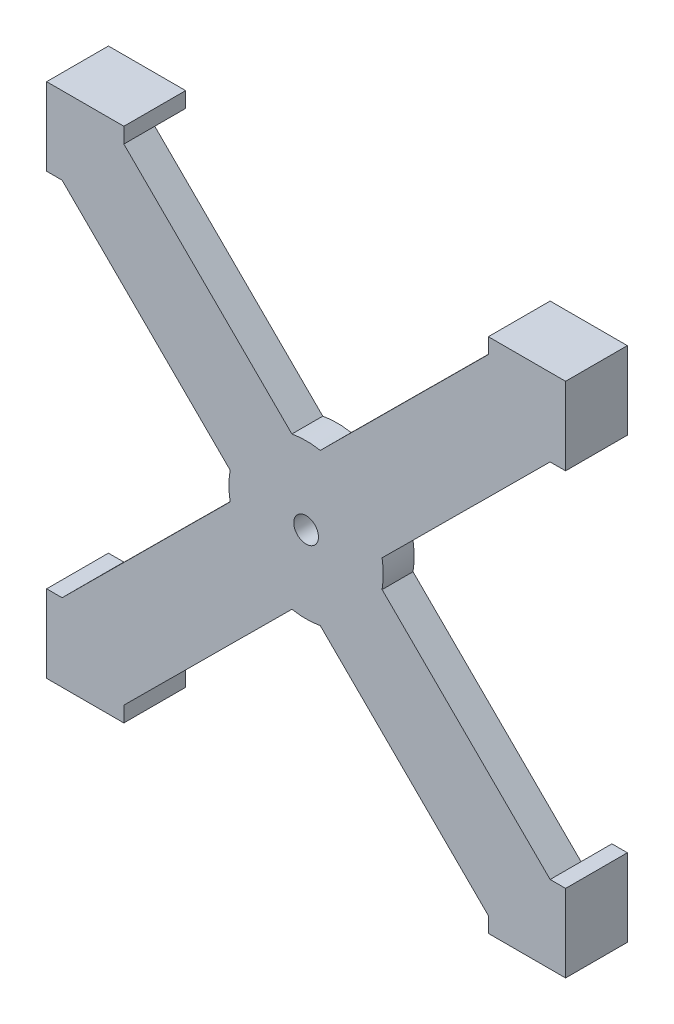
from build123d import *

# Parameters (mm, degrees)
CROQUIS1_R              = 4
SALIENTE_EXTRUIR1_DEPTH = 10
SALIENTE_EXTRUIR2_DEPTH = 20


with BuildPart() as part:
    # Croquis1 → Saliente-Extruir1 (new body)
    with BuildSketch(Plane.XY):
        with BuildLine():
            Line((-59, 78.65), (-4.600099172, 24.573137521))
            ThreePointArc((-4.600099172, 24.573137521), (0, 25), (4.600099172, 24.573137521))
            Line((4.600099172, 24.573137521), (59, 78.65))
            Line((59, 78.65), (79, 78.65))
            Line((79, 78.65), (79, 58.530526224))
            Line((79, 58.530526224), (24.600099172, 4.453663744))
            ThreePointArc((24.600099172, 4.453663744), (25, 0), (24.600099172, -4.453663744))
            Line((24.600099172, -4.453663744), (79, -58.530526224))
            Line((79, -58.530526224), (79, -78.65))
            Line((79, -78.65), (59, -78.65))
            Line((59, -78.65), (4.600099172, -24.573137521))
            ThreePointArc((4.600099172, -24.573137521), (0, -25), (-4.600099172, -24.573137521))
            Line((-4.600099172, -24.573137521), (-59, -78.65))
            Line((-59, -78.65), (-79, -78.65))
            Line((-79, -78.65), (-79, -58.530526224))
            Line((-79, -58.530526224), (-24.600099172, -4.453663744))
            ThreePointArc((-24.600099172, -4.453663744), (-25, 0), (-24.600099172, 4.453663744))
            Line((-24.600099172, 4.453663744), (-79, 58.530526224))
            Line((-79, 58.530526224), (-79, 78.65))
            Line((-79, 78.65), (-59, 78.65))
        make_face()
        Circle(CROQUIS1_R, mode=Mode.SUBTRACT)
    extrude(amount=SALIENTE_EXTRUIR1_DEPTH)

    # Croquis4 → Saliente-Extruir2 (add)
    with BuildSketch(Plane.XY.offset(10)):
        Polygon((-59, 78.65), (-79, 78.65), (-79, 58.530526224), (-84, 58.530526224), (-84, 83.65), (-79, 83.65), (-59, 83.65), align=None)
        Polygon((59, 78.65), (59, 83.65), (79, 83.65), (84, 83.65), (84, 58.530526224), (79, 58.530526224), (79, 78.65), align=None)
        Polygon((59, -78.65), (79, -78.65), (79, -58.530526224), (84, -58.530526224), (84, -83.65), (79, -83.65), (59, -83.65), align=None)
        Polygon((-59, -78.65), (-59, -83.65), (-79, -83.65), (-84, -83.65), (-84, -58.530526224), (-79, -58.530526224), (-79, -78.65), align=None)
    extrude(amount=-SALIENTE_EXTRUIR2_DEPTH)


solid = part.part
